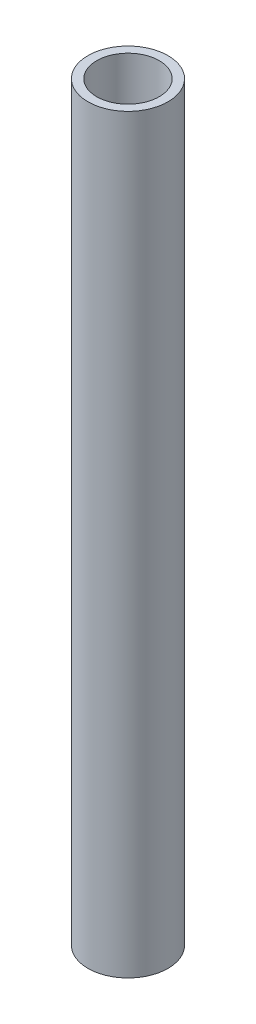
from build123d import *

# Parameters (mm, degrees)
SKETCH_1_R      = 16
SKETCH_1_R_2    = 12.5
EXTRUDE_1_DEPTH = 300


with BuildPart() as part:
    # Эскиз1 → Вытянуть1 (new body)
    with BuildSketch(Plane(origin=(0, 0, 0), x_dir=(1, 0, 0), z_dir=(0, 1, 0))):
        with Locations(Location((0, 0, 0), (0, 0, 270))):
            Circle(SKETCH_1_R)
        with Locations(Location((0, 0, 0), (0, 0, 270))):
            Circle(SKETCH_1_R_2, mode=Mode.SUBTRACT)
    extrude(amount=EXTRUDE_1_DEPTH)


solid = part.part
